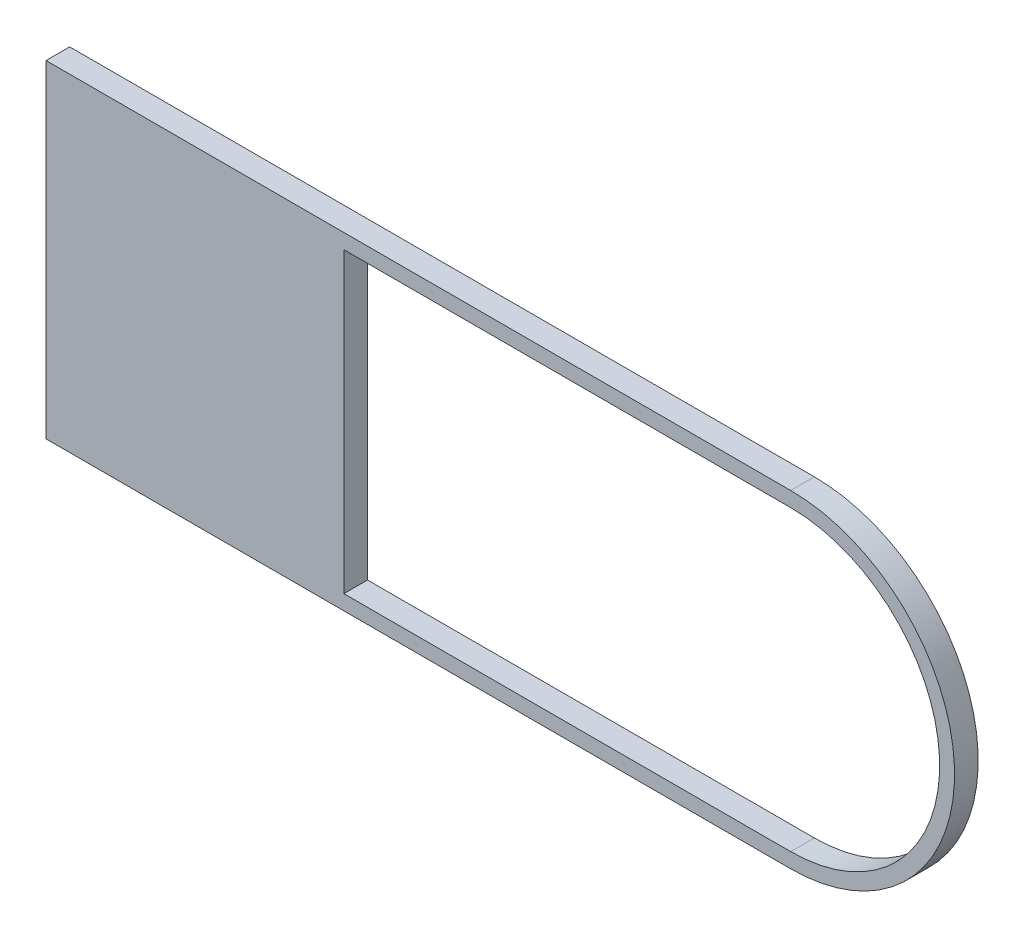
from build123d import *

# Parameters (mm, degrees)
BOSS_EXTRUDE1_DEPTH = 3.175


with BuildPart() as part:
    # Sketch1 → Boss-Extrude1 (new body)
    with BuildSketch(Plane.XY):
        with BuildLine():
            Line((0, 0), (100, 0))
            ThreePointArc((100, 0), (122, 22), (100, 44))
            Line((100, 44), (0, 44))
            Line((0, 44), (0, 0))
        make_face()
        with BuildLine():
            Line((40, 2), (40, 42))
            Line((40, 42), (100, 42))
            ThreePointArc((100, 42), (120, 22), (100, 2))
            Line((100, 2), (40, 2))
        make_face(mode=Mode.SUBTRACT)
    extrude(amount=BOSS_EXTRUDE1_DEPTH)


solid = part.part
